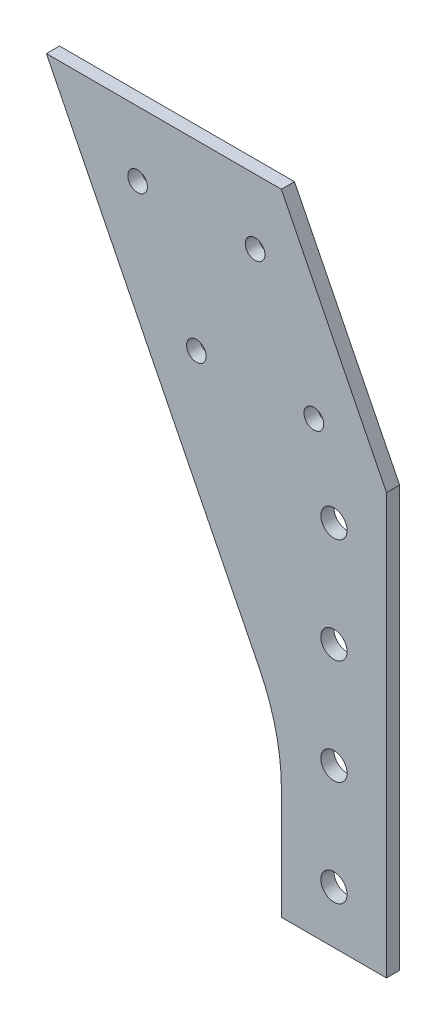
from build123d import *

# Parameters (mm, degrees)
BOSS_EXTRUDE1_DEPTH = 3.175
FILLET1_R           = 50.8
SKETCH2_R           = 3.175
CUT_EXTRUDE1_DEPTH  = 131.731020699
SKETCH3_R           = 2.38125
CUT_EXTRUDE2_DEPTH  = 131.731020699
SKETCH4_W           = 148.329762774
SKETCH4_H           = 42.508472293
CUT_EXTRUDE3_DEPTH  = 131.731020699


with BuildPart() as part:
    # Sketch1 → Boss-Extrude1 (new body)
    with BuildSketch(Plane.XY):
        Polygon((12.7, -76.2), (12.7, 25.4), (-25.408227408, 101.6), (-82.206807187, 101.6), (-12.7, -37.383601913), (-12.7, -76.2), align=None)
    extrude(amount=BOSS_EXTRUDE1_DEPTH)

    # Fillet1
    fillet1_edges = [part.edges().sort_by_distance(p)[0] for p in [
        (-12.7, -37.383601913, 1.5875),
    ]]
    fillet(fillet1_edges, radius=FILLET1_R)

    # Sketch2 → Cut-Extrude1 (cut, through all)
    with BuildSketch(Plane(origin=(0, 0, 0), x_dir=(-1, 0, 0), z_dir=(0, 0, -1))):
        with Locations((0, -63.5)):
            Circle(SKETCH2_R)
        with Locations((0, -38.1)):
            Circle(SKETCH2_R)
        with Locations((0, -12.7)):
            Circle(SKETCH2_R)
        with Locations((0, 12.7)):
            Circle(SKETCH2_R)
    extrude(amount=-CUT_EXTRUDE1_DEPTH, mode=Mode.SUBTRACT)

    # Sketch3 → Cut-Extrude2 (cut, through all)
    with BuildSketch(Plane(origin=(0, 0, 0), x_dir=(-1, 0, 0), z_dir=(0, 0, -1))):
        with Locations((33.256501118, 88.9)):
            Circle(SKETCH3_R)
        with Locations((61.655791008, 88.9)):
            Circle(SKETCH3_R)
        with Locations((19.055016681, 60.503163208)):
            Circle(SKETCH3_R)
        with Locations((47.45430657, 60.503163208)):
            Circle(SKETCH3_R)
        with Locations((4.853532243, 32.106326416)):
            Circle(SKETCH3_R)
        with Locations((33.252822133, 32.106326416)):
            Circle(SKETCH3_R)
    extrude(amount=-CUT_EXTRUDE2_DEPTH, mode=Mode.SUBTRACT)

    # Sketch4 → Cut-Extrude3 (cut, through all)
    with BuildSketch(Plane(origin=(0, 0, 0), x_dir=(-1, 0, 0), z_dir=(0, 0, -1))):
        with Locations((56.905806916, 97.454236147)):
            Rectangle(SKETCH4_W, SKETCH4_H)
    extrude(amount=-CUT_EXTRUDE3_DEPTH, mode=Mode.SUBTRACT)


solid = part.part
